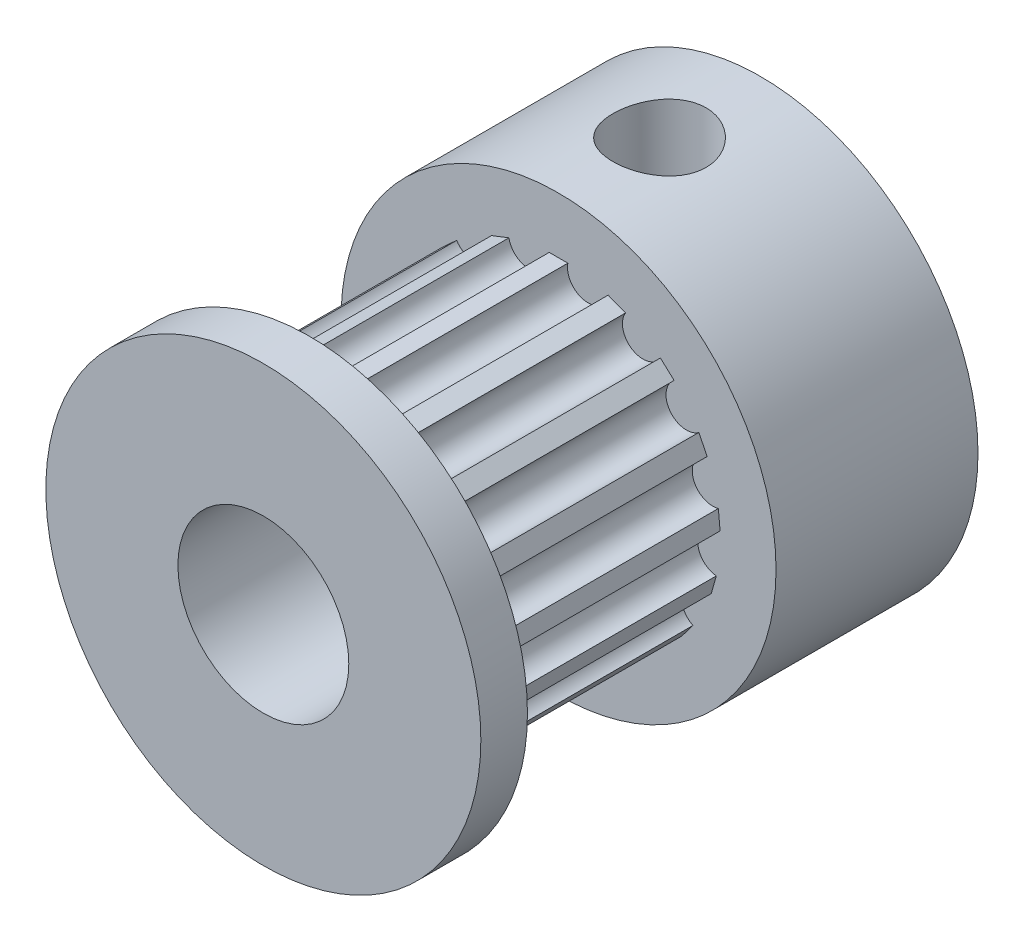
from build123d import *

# Parameters (mm, degrees)
ESQUISSE1_R                  = 7
BOSS_EXTRU_1_DEPTH           = 6.5
BOSS_EXTRU_2_DEPTH           = 8
ESQUISSE4_R                  = 7
BOSS_EXTRU_3_DEPTH           = 1.5
ESQUISSE5_R                  = 2.75
ENL_V_MAT_EXTRU_1_DEPTH      = 16
ENL_V_MAT_EXTRU_3_REACH      = 20.815
ENL_V_MAT_EXTRU_3_END_RADIUS = 7
ESQUISSE8_R                  = 1.5


with BuildPart() as part:
    # Esquisse1 → Boss.-Extru.1 (new body)
    with BuildSketch(Plane.XY):
        with Locations(Location((0, 0, 0), (0, 0, 180))):
            Circle(ESQUISSE1_R)
    extrude(amount=BOSS_EXTRU_1_DEPTH)

    # Esquisse3 → Boss.-Extru.2 (add)
    with BuildSketch(Plane.XY.offset(6.5)):
        with BuildLine():
            Line((0, 5.194220739), (0.3, 5.194220739))
            ThreePointArc((0.3, 5.194220739), (0.827122819, 4.424716273), (1.596627286, 4.951839093))
            Line((1.596627286, 4.951839093), (1.876368954, 4.843466593))
            Line((1.876368954, 4.843466593), (2.156110623, 4.735094093))
            ThreePointArc((2.156110623, 4.735094093), (2.369660938, 3.827133822), (3.277621209, 4.040684138))
            Line((3.277621209, 4.040684138), (3.499323884, 3.838575444))
            Line((3.499323884, 3.838575444), (3.721026559, 3.636466751))
            ThreePointArc((3.721026559, 3.636466751), (3.592163217, 2.712675742), (4.515954226, 2.583812399))
            Line((4.515954226, 2.583812399), (4.649675733, 2.315263412))
            Line((4.649675733, 2.315263412), (4.78339724, 2.046714425))
            ThreePointArc((4.78339724, 2.046714425), (4.329523948, 1.231855771), (5.144382602, 0.777982479))
            Line((5.144382602, 0.777982479), (5.172063109, 0.479262226))
            Line((5.172063109, 0.479262226), (5.199743617, 0.180541973))
            ThreePointArc((5.199743617, 0.180541973), (4.482158479, -0.415333148), (5.0780336, -1.132918286))
            Line((5.0780336, -1.132918286), (4.995934703, -1.421465979))
            Line((4.995934703, -1.421465979), (4.913835806, -1.710013672))
            ThreePointArc((4.913835806, -1.710013672), (4.029452671, -2.006429023), (4.325868023, -2.890812158))
            Line((4.325868023, -2.890812158), (4.145077632, -3.130217327))
            Line((4.145077632, -3.130217327), (3.964287241, -3.369622495))
            ThreePointArc((3.964287241, -3.369622495), (3.032546952, -3.326545541), (2.989469999, -4.258285831))
            Line((2.989469999, -4.258285831), (2.734404858, -4.416215479))
            Line((2.734404858, -4.416215479), (2.479339718, -4.574145128))
            ThreePointArc((2.479339718, -4.574145128), (1.626078963, -4.197393651), (1.249327486, -5.050654405))
            Line((1.249327486, -5.050654405), (0.954435556, -5.105779261))
            Line((0.954435556, -5.105779261), (0.659543626, -5.160904116))
            ThreePointArc((0.659543626, -5.160904116), (0, -4.50136049), (-0.659543626, -5.160904116))
            Line((-0.659543626, -5.160904116), (-0.954435556, -5.105779261))
            Line((-0.954435556, -5.105779261), (-1.249327486, -5.050654405))
            ThreePointArc((-1.249327486, -5.050654405), (-1.626078963, -4.197393651), (-2.479339718, -4.574145128))
            Line((-2.479339718, -4.574145128), (-2.734404858, -4.416215479))
            Line((-2.734404858, -4.416215479), (-2.989469999, -4.258285831))
            ThreePointArc((-2.989469999, -4.258285831), (-3.032546952, -3.326545541), (-3.964287241, -3.369622495))
            Line((-3.964287241, -3.369622495), (-4.145077632, -3.130217327))
            Line((-4.145077632, -3.130217327), (-4.325868023, -2.890812158))
            ThreePointArc((-4.325868023, -2.890812158), (-4.029452671, -2.006429023), (-4.913835806, -1.710013672))
            Line((-4.913835806, -1.710013672), (-4.995934703, -1.421465979))
            Line((-4.995934703, -1.421465979), (-5.0780336, -1.132918286))
            ThreePointArc((-5.0780336, -1.132918286), (-4.482158479, -0.415333148), (-5.199743617, 0.180541973))
            Line((-5.199743617, 0.180541973), (-5.172063109, 0.479262226))
            Line((-5.172063109, 0.479262226), (-5.144382602, 0.777982479))
            ThreePointArc((-5.144382602, 0.777982479), (-4.329523948, 1.231855771), (-4.78339724, 2.046714425))
            Line((-4.78339724, 2.046714425), (-4.649675733, 2.315263412))
            Line((-4.649675733, 2.315263412), (-4.515954226, 2.583812399))
            ThreePointArc((-4.515954226, 2.583812399), (-3.592163217, 2.712675742), (-3.721026559, 3.636466751))
            Line((-3.721026559, 3.636466751), (-3.499323884, 3.838575444))
            Line((-3.499323884, 3.838575444), (-3.277621209, 4.040684138))
            ThreePointArc((-3.277621209, 4.040684138), (-2.369660938, 3.827133822), (-2.156110623, 4.735094093))
            Line((-2.156110623, 4.735094093), (-1.876368954, 4.843466593))
            Line((-1.876368954, 4.843466593), (-1.596627286, 4.951839093))
            ThreePointArc((-1.596627286, 4.951839093), (-0.827122819, 4.424716273), (-0.3, 5.194220739))
            Line((-0.3, 5.194220739), (0, 5.194220739))
        make_face()
    extrude(amount=BOSS_EXTRU_2_DEPTH)

    # Esquisse4 → Boss.-Extru.3 (add)
    with BuildSketch(Plane.XY.offset(14.5)):
        with Locations(Location((0, 0, 0), (0, 0, 180))):
            Circle(ESQUISSE4_R)
    extrude(amount=BOSS_EXTRU_3_DEPTH)

    # Esquisse5 → Enlèv. mat.-Extru.1 (cut)
    with BuildSketch(Plane(origin=(0, 0, 0), x_dir=(-1, 0, 0), z_dir=(0, 0, -1))):
        Circle(ESQUISSE5_R)
    extrude(amount=-ENL_V_MAT_EXTRU_1_DEPTH, mode=Mode.SUBTRACT)

    # Enlèv. mat.-Extru.3: up to this cylinder (the profile starts inside it)
    enl_v_mat_extru_3_end = Plane(origin=(0, 0, 3.25), z_dir=(0, 0, -1)) * Cylinder(ENL_V_MAT_EXTRU_3_END_RADIUS, 56.63, mode=Mode.PRIVATE)
    # Esquisse8 → Enlèv. mat.-Extru.3 (cut, up to the surface)
    with BuildSketch(Plane(origin=(0, 0, 0), x_dir=(1, 0, 0), z_dir=(0, 1, 0)), mode=Mode.PRIVATE) as enl_v_mat_extru_3_sk1:
        with Locations(Location((0, -3.25, 0), (0, 0, 90))):
            Circle(ESQUISSE8_R)
    enl_v_mat_extru_3_tool1 = extrude(enl_v_mat_extru_3_sk1.sketch, amount=ENL_V_MAT_EXTRU_3_REACH, mode=Mode.PRIVATE) & enl_v_mat_extru_3_end
    add(enl_v_mat_extru_3_tool1.solids().sort_by_distance((0, 0, 3.25))[0], mode=Mode.SUBTRACT)


solid = part.part
